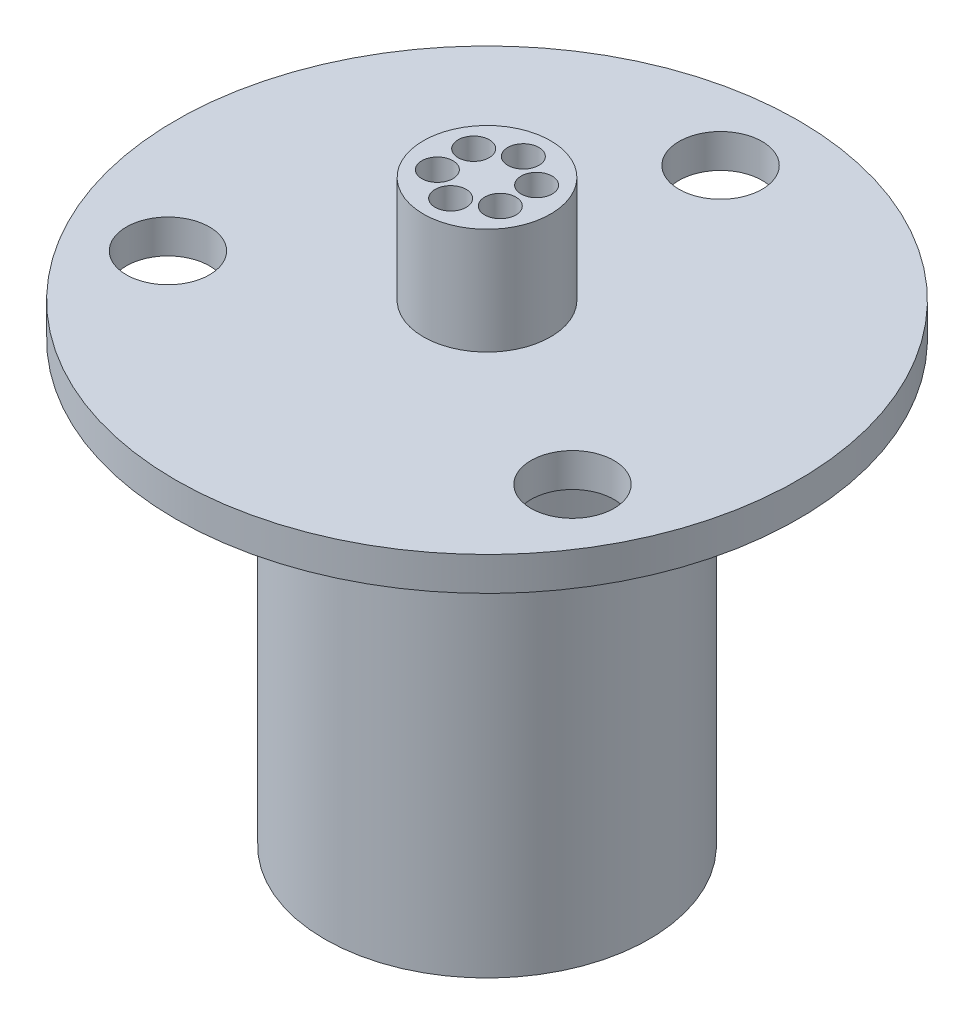
from build123d import *

# Parameters (mm, degrees)
ESBO_O1_R                = 6.25
RESSALTO_EXTRUS_O1_DEPTH = 16.9
ESBO_O2_R                = 12
RESSALTO_EXTRUS_O2_DEPTH = 1.3
ESBO_O3_R                = 1.6
CORTE_EXTRUS_O1_DEPTH    = 25.884533349
ESBO_O4_R                = 2.45
RESSALTO_EXTRUS_O3_DEPTH = 4.1
ESBO_O5_R                = 0.6
CORTE_EXTRUS_O2_DEPTH    = 1
ESBO_O7_R                = 0.6
CORTE_EXTRUS_O3_DEPTH    = 1


with BuildPart() as part:
    # Esboço1 → Ressalto-extrusão1 (new body)
    with BuildSketch(Plane(origin=(0, 0, 0), x_dir=(1, 0, 0), z_dir=(0, 1, 0))):
        with Locations(Location((0, 0, 0), (0, 0, 270))):
            Circle(ESBO_O1_R)
    extrude(amount=RESSALTO_EXTRUS_O1_DEPTH)

    # Esboço2 → Ressalto-extrusão2 (add)
    with BuildSketch(Plane(origin=(0, 16.9, 0), x_dir=(1, 0, 0), z_dir=(0, 1, 0))):
        with Locations(Location((0, 0, 0), (0, 0, 270))):
            Circle(ESBO_O2_R)
    extrude(amount=RESSALTO_EXTRUS_O2_DEPTH)

    # Esboço3 → Corte-extrusão1 (cut, through all)
    with BuildSketch(Plane(origin=(0, 18.2, 0), x_dir=(1, 0, 0), z_dir=(0, 1, 0))):
        with Locations(Location((0, 9, 0), (0, 0, 270))):
            Circle(ESBO_O3_R)
        with Locations(Location((7.794228634, -4.5, 0), (0, 0, 270))):
            Circle(ESBO_O3_R)
        with Locations(Location((-7.794228634, -4.5, 0), (0, 0, 270))):
            Circle(ESBO_O3_R)
    extrude(amount=-CORTE_EXTRUS_O1_DEPTH, mode=Mode.SUBTRACT)

    # Esboço4 → Ressalto-extrusão3 (add)
    with BuildSketch(Plane(origin=(0, 18.2, 0), x_dir=(1, 0, 0), z_dir=(0, 1, 0))):
        with Locations(Location((0, 0, 0), (0, 0, 270))):
            Circle(ESBO_O4_R)
    extrude(amount=RESSALTO_EXTRUS_O3_DEPTH)

    # Esboço5 → Corte-extrusão2 (cut)
    with BuildSketch(Plane(origin=(0, 22.3, 0), x_dir=(1, 0, 0), z_dir=(0, 1, 0))):
        with Locations(Location((0, 1.4, 0), (0, 0, 270))):
            Circle(ESBO_O5_R)
        with Locations(Location((1.212435565, 0.7, 0), (0, 0, 270))):
            Circle(ESBO_O5_R)
        with Locations(Location((1.212435565, -0.7, 0), (0, 0, 270))):
            Circle(ESBO_O5_R)
        with Locations(Location((0, -1.4, 0), (0, 0, 270))):
            Circle(ESBO_O5_R)
        with Locations(Location((-1.212435565, -0.7, 0), (0, 0, 270))):
            Circle(ESBO_O5_R)
        with Locations(Location((-1.212435565, 0.7, 0), (0, 0, 270))):
            Circle(ESBO_O5_R)
    extrude(amount=-CORTE_EXTRUS_O2_DEPTH, mode=Mode.SUBTRACT)

    # Esboço7 → Corte-extrusão3 (cut)
    with BuildSketch(Plane.XZ):
        with Locations(Location((0, 4.5, 0), (0, 0, 270))):
            Circle(ESBO_O7_R)
        with Locations(Location((1.901782178, 4.078385042, 0), (0, 0, 270))):
            Circle(ESBO_O7_R)
        with Locations(Location((-1.901782178, 4.078385042, 0), (0, 0, 90))):
            Circle(ESBO_O7_R)
        with Locations(Location((-1.901782178, -4.078385042, 0), (0, 0, 270))):
            Circle(ESBO_O7_R)
        with Locations(Location((1.901782178, -4.078385042, 0), (0, 0, 90))):
            Circle(ESBO_O7_R)
        with Locations(Location((0, -4.5, 0), (0, 0, 90))):
            Circle(ESBO_O7_R)
    extrude(amount=-CORTE_EXTRUS_O3_DEPTH, mode=Mode.SUBTRACT)


solid = part.part
